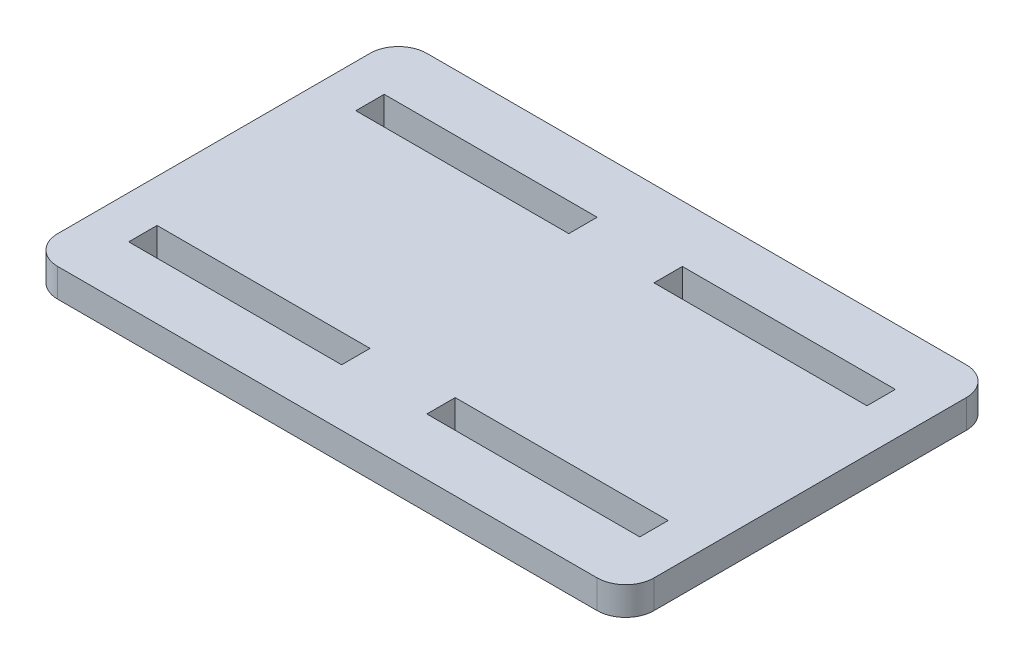
from build123d import *

# Parameters (mm, degrees)
SKETCH1_W               = 17.78
SKETCH1_H               = 2.54
BOSS_EXTRUDE1_DEPTH     = 11.43
SKETCH2_W               = 17.78
SKETCH2_H               = 2.54
BOSS_EXTRUDE2_DEPTH     = 15.24
SKETCH16_W              = 3.81
SKETCH16_H              = 2.54
BOSS_EXTRUDE10_DEPTH    = 7.62
BOSS_EXTRUDE11_REACH    = 36.757
SKETCH17_W              = 5.08
SKETCH17_H              = 2.54
MIRROR3_COPY_1_SKETCH_W = 3.81
MIRROR3_COPY_1_SKETCH_H = 2.54
MIRROR3_COPY_1_DEPTH    = 7.62
MIRROR3_COPY_2_REACH    = 36.757
MIRROR3_COPY_2_SKETCH_W = 5.08
MIRROR3_COPY_2_SKETCH_H = 2.54
FILLET1_R               = 2.54
SKETCH18_W              = 5.0165
SKETCH18_H              = 17.78
BOSS_EXTRUDE12_DEPTH    = 5.0165
SKETCH19_W              = 17.78
SKETCH19_H              = 2.4765
BOSS_EXTRUDE13_DEPTH    = 5.0165


with BuildPart() as part:
    # Sketch1 → Boss-Extrude1 (new body)
    with BuildSketch(Plane(origin=(0, 0, 0), x_dir=(0, 0, -1), z_dir=(1, 0, 0))):
        with Locations((0, 1.27)):
            Rectangle(SKETCH1_W, SKETCH1_H)
    extrude(amount=BOSS_EXTRUDE1_DEPTH)

    # Sketch2 → Boss-Extrude2 (add)
    with BuildSketch(Plane.ZY):
        with Locations((0, 1.27)):
            Rectangle(SKETCH2_W, SKETCH2_H)
    extrude(amount=BOSS_EXTRUDE2_DEPTH)

    # Mirror1: part across plane


with BuildPart() as part_1:
    add(part.part)
    add(part.part.mirror(Plane.ZY.offset(15.24)))

    # Sketch16 → Boss-Extrude10 (add)
    with BuildSketch(Plane.XY.offset(8.89)):
        with Locations((-17.145, 1.27)):
            Rectangle(SKETCH16_W, SKETCH16_H)
        with Locations((-40.005, 1.27)):
            Rectangle(SKETCH16_W, SKETCH16_H)
    boss_extrude10 = extrude(amount=BOSS_EXTRUDE10_DEPTH)

    # Sketch17 → Boss-Extrude11 (add, up to next)
    with BuildSketch(Plane.ZY.offset(19.05), mode=Mode.PRIVATE) as boss_extrude11_sk1:
        with Locations((13.97, 1.27)):
            Rectangle(SKETCH17_W, SKETCH17_H)
    boss_extrude11_tool1 = extrude(boss_extrude11_sk1.sketch, amount=BOSS_EXTRUDE11_REACH, mode=Mode.PRIVATE) - part_1.part
    boss_extrude11 = boss_extrude11_tool1.solids().sort_by_distance((-19.05, 1.27, 13.97))[0]
    add(boss_extrude11)

    # Mirror2: Boss-Extrude10, Boss-Extrude11 across plane
    add(boss_extrude10.mirror(Plane.ZY.offset(15.24)))
    add(boss_extrude11.mirror(Plane.ZY.offset(15.24)))

    # Mirror3: Boss-Extrude10, Boss-Extrude11 across plane
    add(boss_extrude10.mirror(Plane.XY))
    add(boss_extrude11.mirror(Plane.XY))

    # Mirror3 copy 1 sketch → Mirror3 copy 1 (add)
    with BuildSketch(Plane(origin=(-30.48, 0, -8.89), x_dir=(-1, 0, 0), z_dir=(0, 0, -1))):
        with Locations((-17.145, 1.27)):
            Rectangle(MIRROR3_COPY_1_SKETCH_W, MIRROR3_COPY_1_SKETCH_H)
        with Locations((-40.005, 1.27)):
            Rectangle(MIRROR3_COPY_1_SKETCH_W, MIRROR3_COPY_1_SKETCH_H)
    extrude(amount=MIRROR3_COPY_1_DEPTH)

    # Mirror3 copy 2 sketch → Mirror3 copy 2 (add, up to next)
    with BuildSketch(Plane(origin=(-11.43, 0, 0), x_dir=(0, 0, -1), z_dir=(1, 0, 0)), mode=Mode.PRIVATE) as mirror3_copy_2_sk1:
        with Locations((13.97, 1.27)):
            Rectangle(MIRROR3_COPY_2_SKETCH_W, MIRROR3_COPY_2_SKETCH_H)
    mirror3_copy_2_tool1 = extrude(mirror3_copy_2_sk1.sketch, amount=MIRROR3_COPY_2_REACH, mode=Mode.PRIVATE) - part_1.part
    add(mirror3_copy_2_tool1.solids().sort_by_distance((-11.43, 1.27, -13.97))[0])

    # Fillet1
    fillet1_edges = [part_1.edges().sort_by_distance(p)[0] for p in [
        (-41.91, 1.27, -16.51),
        (11.43, 1.27, -16.51),
        (-41.91, 1.27, 16.51),
        (11.43, 1.27, 16.51),
    ]]
    fillet(fillet1_edges, radius=FILLET1_R)

    # Sketch18 → Boss-Extrude12 (add)
    with BuildSketch(Plane.XZ):
        with Locations((-12.73175, 0)):
            Rectangle(SKETCH18_W, SKETCH18_H)
    boss_extrude12 = extrude(amount=BOSS_EXTRUDE12_DEPTH)

    # Sketch19 → Boss-Extrude13 (add)
    with BuildSketch(Plane(origin=(-10.2235, 0, 0), x_dir=(0, 0, -1), z_dir=(1, 0, 0))):
        with Locations((0, -3.77825)):
            Rectangle(SKETCH19_W, SKETCH19_H)
    boss_extrude13 = extrude(amount=BOSS_EXTRUDE13_DEPTH)

    # Mirror4: Boss-Extrude12, Boss-Extrude13 across plane
    add(boss_extrude12.mirror(Plane.ZY.offset(15.24)))
    add(boss_extrude13.mirror(Plane.ZY.offset(15.24)))


solid = part_1.part
